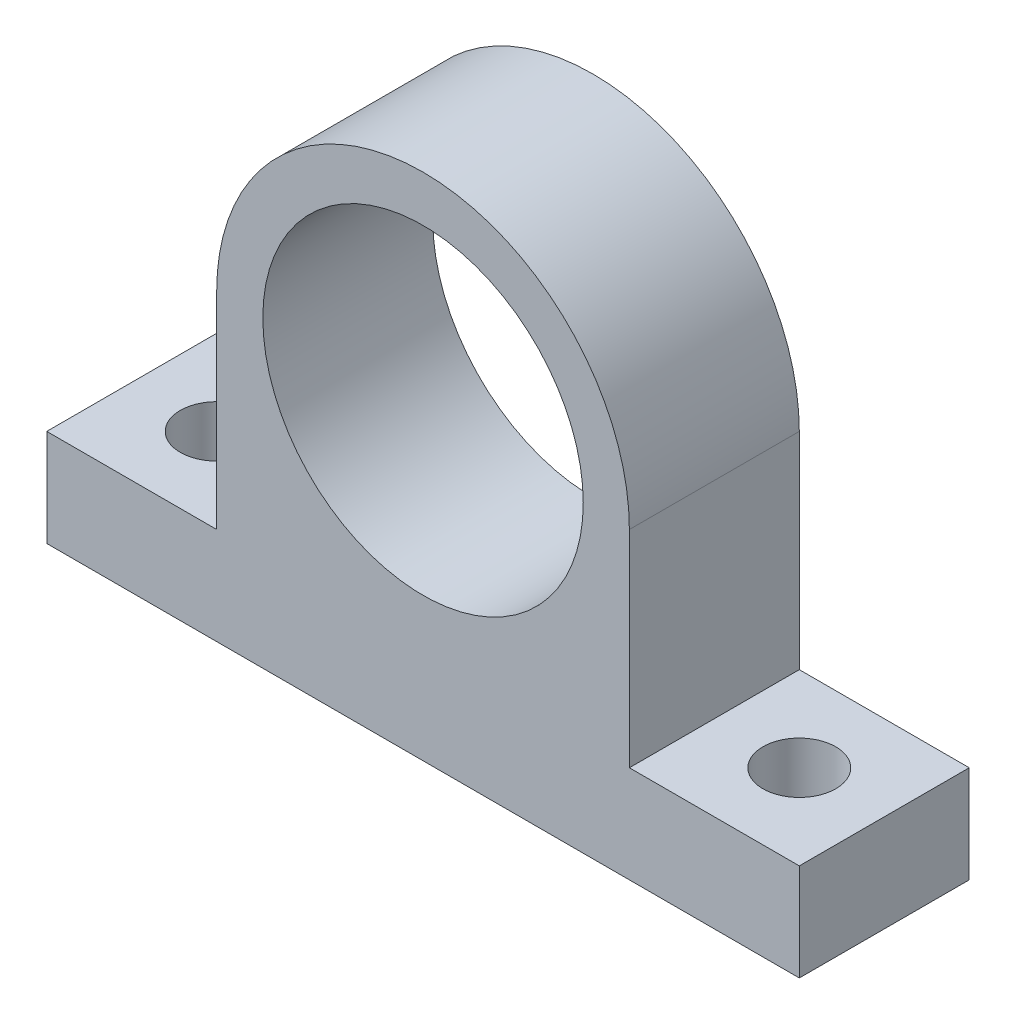
from build123d import *

# Parameters (mm, degrees)
SKETCH_1_R          = 6.6
EXTRUDE_1_DEPTH     = 7
SKETCH_2_R          = 1.5
CUT_EXTRUDE_1_DEPTH = 25.046829313


with BuildPart() as part:
    # 草图1 → 凸台-拉伸1 (new body)
    with BuildSketch(Plane.XY):
        with BuildLine():
            Line((-8.5, 0), (-8.5, -8.5))
            Line((-8.5, -8.5), (-15.5, -8.5))
            Line((-15.5, -8.5), (-15.5, -12.5))
            Line((-15.5, -12.5), (-8.5, -12.5))
            Line((-8.5, -12.5), (8.5, -12.5))
            Line((8.5, -12.5), (15.5, -12.5))
            Line((15.5, -12.5), (15.5, -8.5))
            Line((15.5, -8.5), (8.5, -8.5))
            Line((8.5, -8.5), (8.5, 0))
            ThreePointArc((8.5, 0), (0, 8.5), (-8.5, 0))
        make_face()
        Circle(SKETCH_1_R, mode=Mode.SUBTRACT)
    extrude(amount=EXTRUDE_1_DEPTH)

    # 草图2 → 切除-拉伸1 (cut, through all)
    with BuildSketch(Plane(origin=(0, -8.5, 0), x_dir=(1, 0, 0), z_dir=(0, 1, 0))):
        with Locations(Location((-12, -3.5, 0), (0, 0, 180))):
            Circle(SKETCH_2_R)
        with Locations((12, -3.5)):
            Circle(SKETCH_2_R)
    extrude(amount=-CUT_EXTRUDE_1_DEPTH, mode=Mode.SUBTRACT)


solid = part.part
